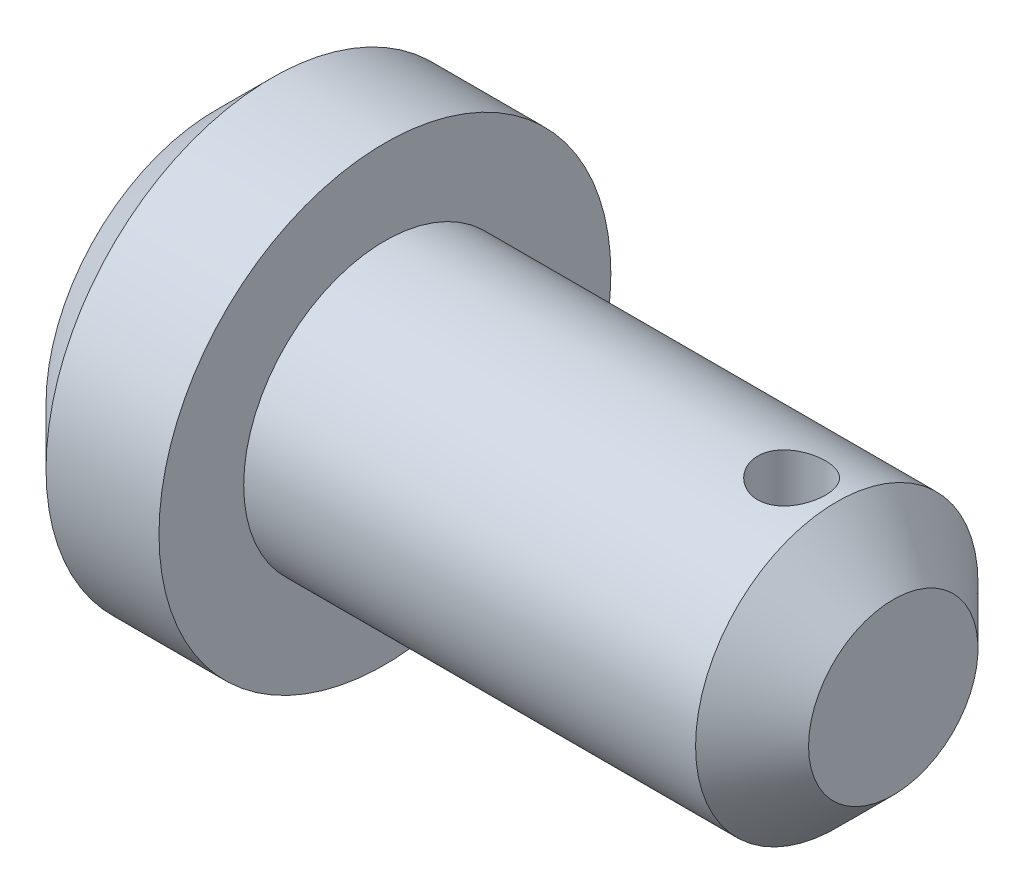
from build123d import *

# Parameters (mm, degrees)
CUT_EXTRUDE1_DEPTH      = 84.754873845
CUT_EXTRUDE1_DEPTH_BACK = 84.754873845
SKETCH2_R               = 6


with BuildPart() as part:
    # Sketch1 → Revolve1 (revolve)
    with BuildSketch(Plane.XY):
        Polygon((-58.235294118, 0), (61.764705882, 0), (61.764705882, 15), (51.764705882, 25), (-28.235294118, 25), (-28.235294118, 40), (-48.235294118, 40), (-58.235294118, 30), align=None)
    revolve(axis=Axis((-58.235294118, 0, 0), (1, 0, 0)))

    # Sketch2 → Cut-Extrude1 (cut, two sides: drawn at the far end of the back side and taken through both)
    with BuildSketch(Plane(origin=(0, 0, 0), x_dir=(1, 0, 0), z_dir=(0, 1, 0)).offset(-CUT_EXTRUDE1_DEPTH_BACK)):
        with Locations((43.764705882, 0)):
            Circle(SKETCH2_R)
    extrude(amount=CUT_EXTRUDE1_DEPTH + CUT_EXTRUDE1_DEPTH_BACK, mode=Mode.SUBTRACT)


solid = part.part
